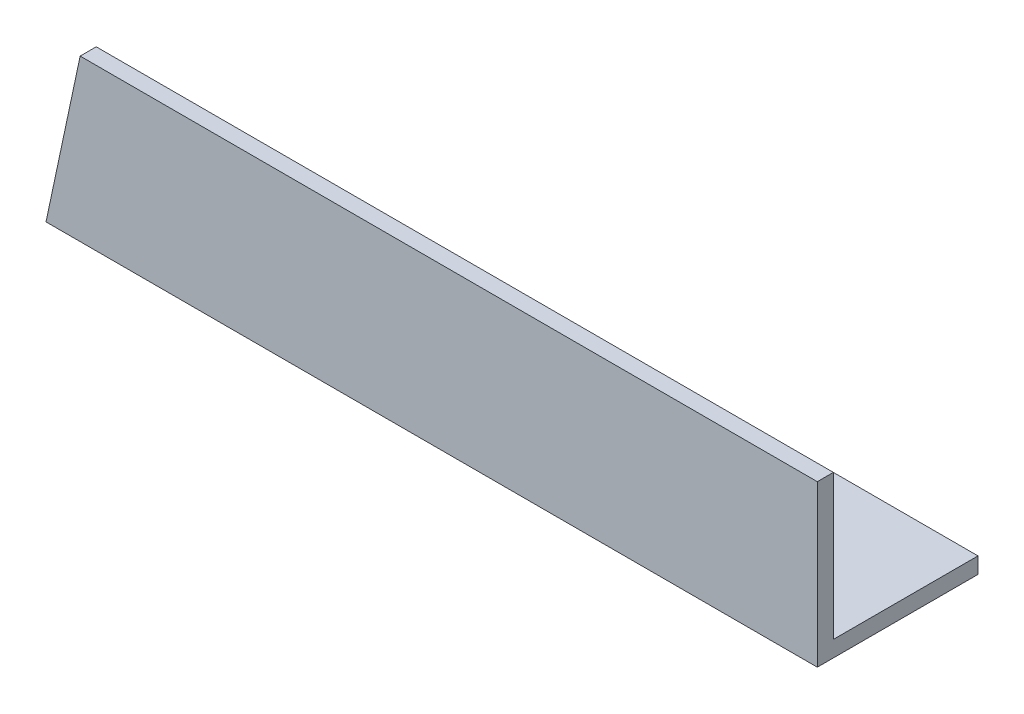
from build123d import *

# Parameters (mm, degrees)
BOSS_EXTRUDE1_DEPTH = 96
CUT_EXTRUDE1_DEPTH  = 101.079968026


with BuildPart() as part:
    # Sketch1 → Boss-Extrude1 (new body)
    with BuildSketch(Plane(origin=(0, 0, 0), x_dir=(0, 0, -1), z_dir=(1, 0, 0))):
        Polygon((0, 20), (0, 0), (20, 0), (20, 2), (2, 2), (2, 20), align=None)
    extrude(amount=BOSS_EXTRUDE1_DEPTH)

    # Sketch2 → Cut-Extrude1 (cut, through all)
    with BuildSketch(Plane.XY):
        Polygon((0, 0), (4.251131233, 20), (0, 20), align=None)
    extrude(amount=-CUT_EXTRUDE1_DEPTH, mode=Mode.SUBTRACT)


solid = part.part
